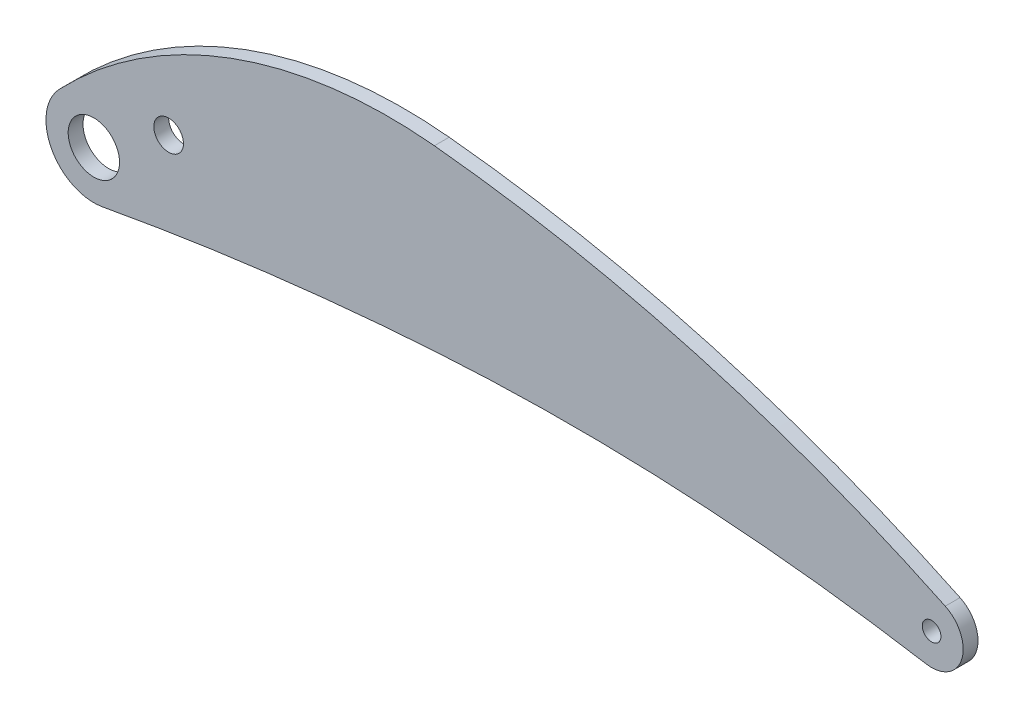
from build123d import *

# Parameters (mm, degrees)
SKETCH1_R               = 11
SKETCH1_R_2             = 4
BOSS_EXTRUDE1_DEPTH     = 6.35
CUT_EXTRUDE1_DEPTH      = 380.972155331
CUT_EXTRUDE1_DEPTH_BACK = 380.972155331
SKETCH2_R               = 6.35


with BuildPart() as part:
    # Sketch1 → Boss-Extrude1 (new body)
    with BuildSketch(Plane.XY):
        with BuildLine():
            ThreePointArc((-14.847301451, 14.171565356), (-18.06169524, -9.749399473), (3.699835438, -20.18878012))
            ThreePointArc((3.699835438, -20.18878012), (74.556998508, -9.322867247), (145.926048807, -2.594993863))
            ThreePointArc((145.926048807, -2.594993863), (251.652155026, -1.855156614), (356.755502219, -13.337460579))
            ThreePointArc((356.755502219, -13.337460579), (371.894318042, -4.08193425), (364.839650306, 12.199348725))
            ThreePointArc((364.839650306, 12.199348725), (258.044932978, 52.392610297), (145.926048807, 73.605006137))
            ThreePointArc((145.926048807, 73.605006137), (58.666161858, 62.481005213), (-14.847301451, 14.171565356))
        make_face()
        Circle(SKETCH1_R, mode=Mode.SUBTRACT)
        with Locations((359, 0)):
            Circle(SKETCH1_R_2, mode=Mode.SUBTRACT)
    extrude(amount=BOSS_EXTRUDE1_DEPTH)

    # Sketch2 → Cut-Extrude1 (cut, two sides: drawn at the far end of the back side and taken through both)
    with BuildSketch(Plane.XY.offset(6.35).offset(-CUT_EXTRUDE1_DEPTH_BACK)):
        with Locations((32.051371855, 20.599018477)):
            Circle(SKETCH2_R)
    extrude(amount=CUT_EXTRUDE1_DEPTH + CUT_EXTRUDE1_DEPTH_BACK, mode=Mode.SUBTRACT)


solid = part.part
